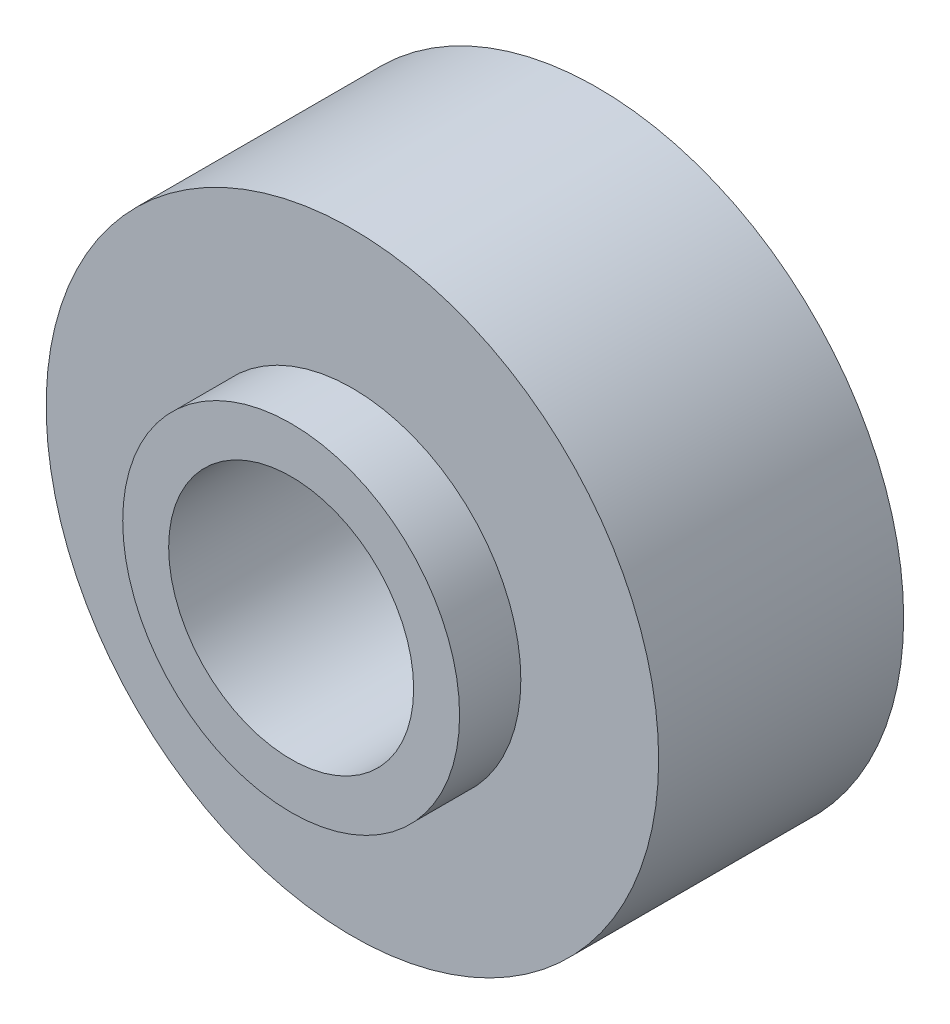
from build123d import *

# Parameters (mm, degrees)
SKETCH_1_R          = 10
SKETCH_1_R_2        = 4
EXTRUDE_1_DEPTH     = 10
SKETCH_2_R          = 10
SKETCH_2_R_2        = 5.5
CUT_EXTRUDE_1_DEPTH = 2


with BuildPart() as part:
    # Эскиз1 → Бобышка-Вытянуть1 (new body)
    with BuildSketch(Plane.XY):
        Circle(SKETCH_1_R)
        Circle(SKETCH_1_R_2, mode=Mode.SUBTRACT)
    extrude(amount=-EXTRUDE_1_DEPTH)

    # Эскиз2 → Вырез-Вытянуть1 (cut)
    with BuildSketch(Plane.XY):
        Circle(SKETCH_2_R)
        Circle(SKETCH_2_R_2, mode=Mode.SUBTRACT)
    extrude(amount=-CUT_EXTRUDE_1_DEPTH, mode=Mode.SUBTRACT)


solid = part.part
